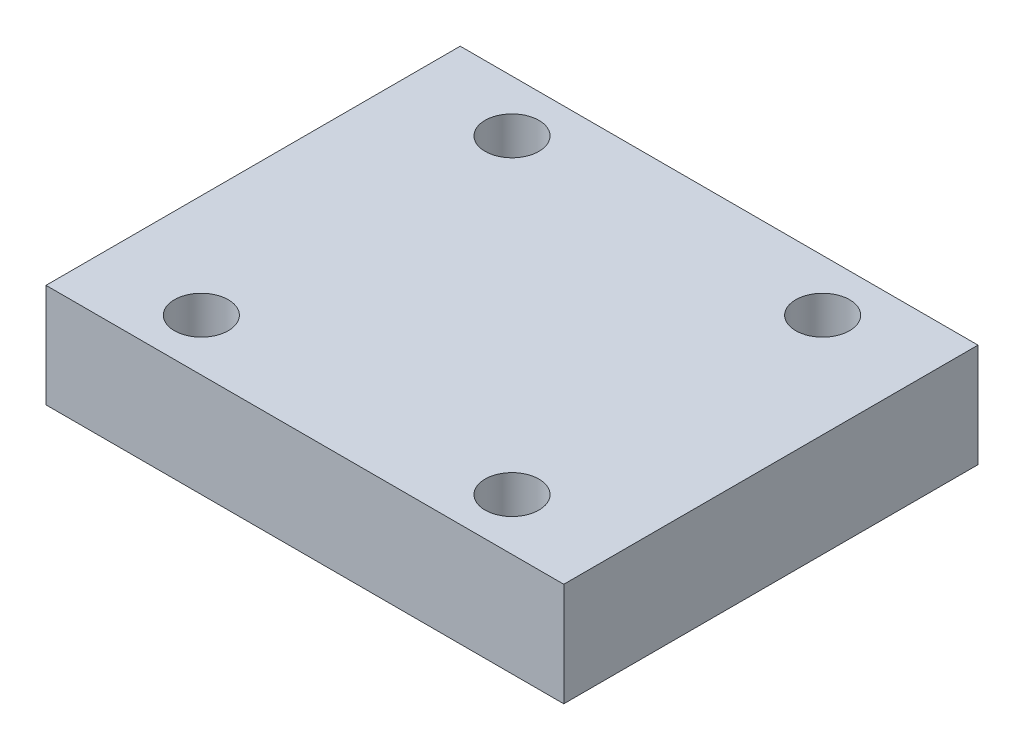
from build123d import *

# Parameters (mm, degrees)
SKETCH_1_W      = 50
SKETCH_1_H      = 40
SKETCH_1_R      = 2.6
EXTRUDE_1_DEPTH = 10


with BuildPart() as part:
    # 草图1 → 凸台-拉伸1 (new body)
    with BuildSketch(Plane(origin=(0, 0, 0), x_dir=(1, 0, 0), z_dir=(0, 1, 0))):
        Rectangle(SKETCH_1_W, SKETCH_1_H)
        with Locations(Location((-15, 15, 0), (0, 0, 270))):
            Circle(SKETCH_1_R, mode=Mode.SUBTRACT)
        with Locations(Location((-15, -15, 0), (0, 0, 90))):
            Circle(SKETCH_1_R, mode=Mode.SUBTRACT)
        with Locations(Location((15, -15, 0), (0, 0, 270))):
            Circle(SKETCH_1_R, mode=Mode.SUBTRACT)
        with Locations(Location((15, 15, 0), (0, 0, 90))):
            Circle(SKETCH_1_R, mode=Mode.SUBTRACT)
    extrude(amount=EXTRUDE_1_DEPTH)


solid = part.part
